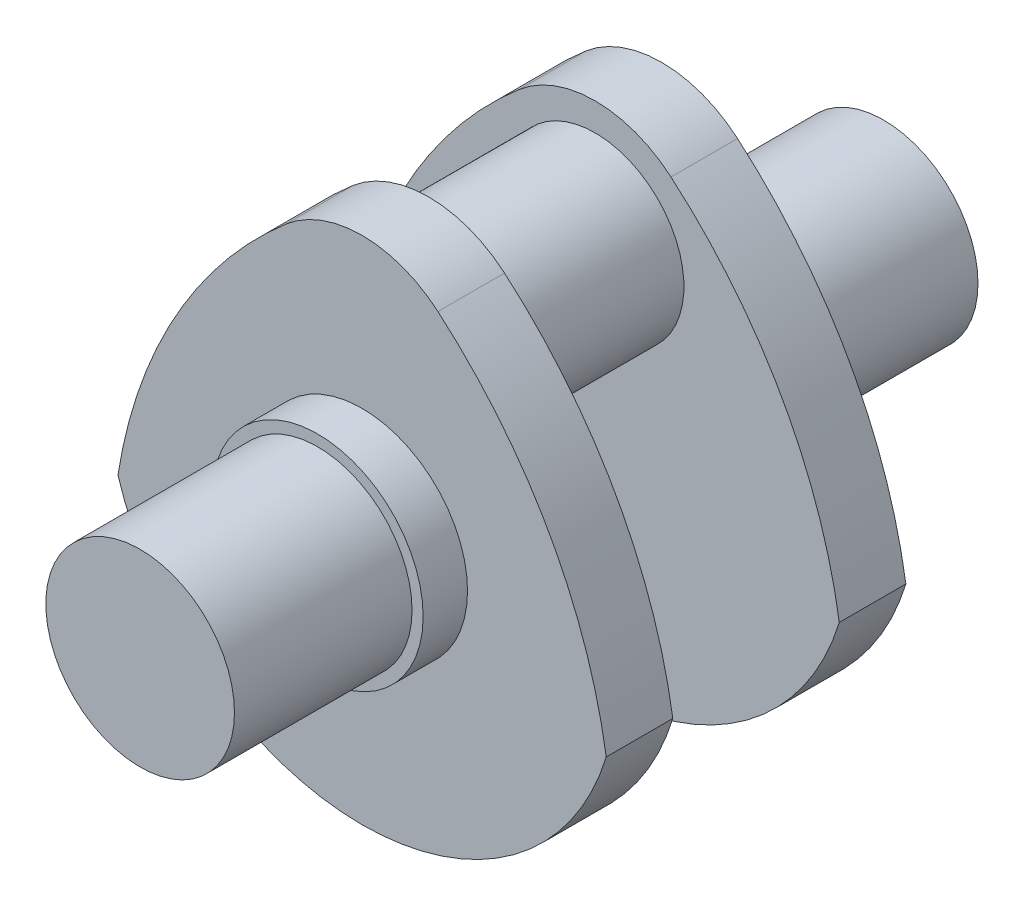
from build123d import *

# Parameters (mm, degrees)
SKETCH3_R           = 17
BOSS_EXTRUDE1_DEPTH = 40
SKETCH6_R           = 19
BOSS_EXTRUDE2_DEPTH = 8
BOSS_EXTRUDE3_DEPTH = 12
SKETCH8_R           = 16
BOSS_EXTRUDE4_DEPTH = 15


with BuildPart() as part:
    # Sketch3 → Boss-Extrude1 (new body)
    with BuildSketch(Plane.XY):
        Circle(SKETCH3_R)
    extrude(amount=BOSS_EXTRUDE1_DEPTH)

    # Sketch6 → Boss-Extrude2 (add)
    with BuildSketch(Plane.XY.offset(40)):
        Circle(SKETCH6_R)
    extrude(amount=-BOSS_EXTRUDE2_DEPTH)

    # Sketch7 → Boss-Extrude3 (add)
    with BuildSketch(Plane.XY.offset(40)):
        with BuildLine():
            ThreePointArc((-44, -13.416407865), (0, -46), (44, -13.416407865))
            ThreePointArc((44, -13.416407865), (33.683444249, 16.469257624), (13.668094758, 40.943123461))
            ThreePointArc((13.668094758, 40.943123461), (0, 46), (-13.668094758, 40.943123461))
            ThreePointArc((-13.668094758, 40.943123461), (-33.683444249, 16.469257624), (-44, -13.416407865))
        make_face()
    extrude(amount=BOSS_EXTRUDE3_DEPTH)

    # Sketch8 → Boss-Extrude4 (add)
    with BuildSketch(Plane.XY.offset(52)):
        with Locations(Location((0, 25, 0), (0, 0, 180))):
            Circle(SKETCH8_R)
    extrude(amount=BOSS_EXTRUDE4_DEPTH)

    # Mirror2: part across plane


with BuildPart() as part_1:
    add(part.part)
    add(part.part.mirror(Plane(origin=(0, 25, 67), x_dir=(1, 0, 0), z_dir=(0, 0, 1))))


solid = part_1.part
